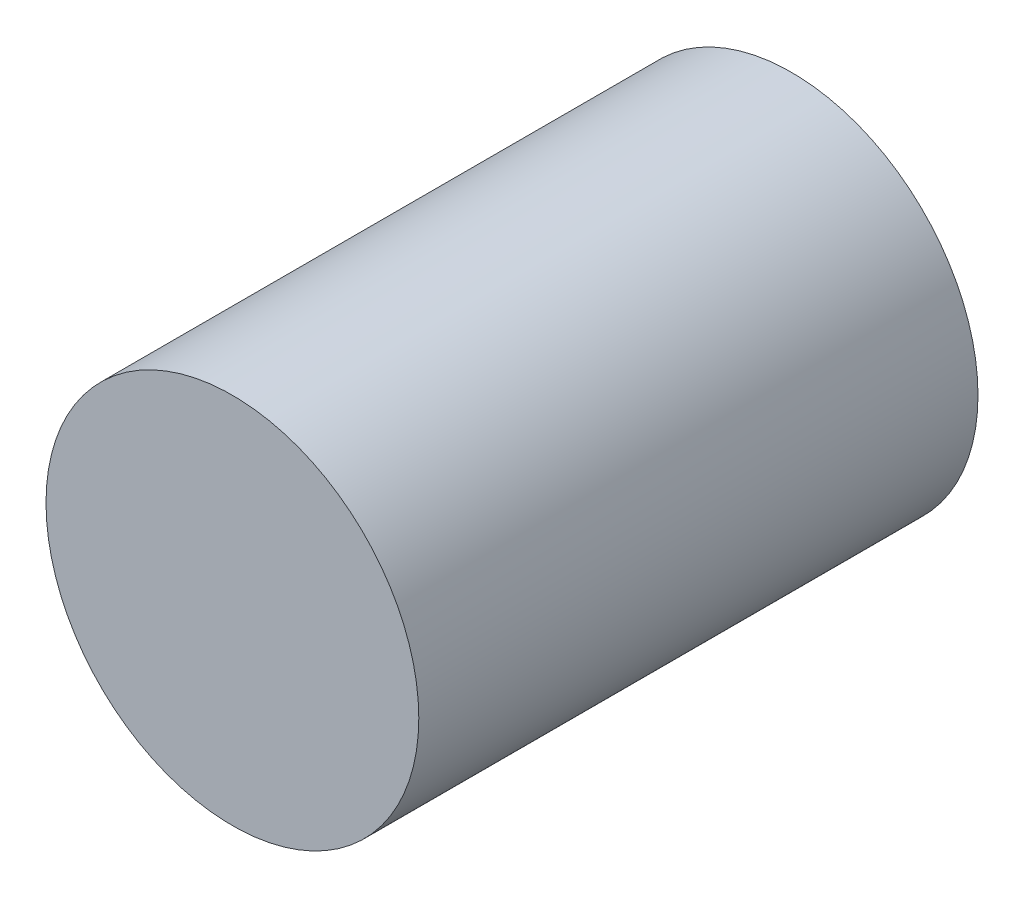
from build123d import *

# Parameters (mm, degrees)
ESQUISSE1_R             = 10
BOSS_EXTRU_1_DEPTH      = 30
ESQUISSE2_R             = 2.5
ENL_V_MAT_EXTRU_1_DEPTH = 10


with BuildPart() as part:
    # Esquisse1 → Boss.-Extru.1 (new body)
    with BuildSketch(Plane.XY):
        Circle(ESQUISSE1_R)
    extrude(amount=BOSS_EXTRU_1_DEPTH)

    # Esquisse2 → Enlèv. mat.-Extru.1 (cut)
    with BuildSketch(Plane(origin=(0, 0, 0), x_dir=(-1, 0, 0), z_dir=(0, 0, -1))):
        Circle(ESQUISSE2_R)
    extrude(amount=-ENL_V_MAT_EXTRU_1_DEPTH, mode=Mode.SUBTRACT)


solid = part.part
